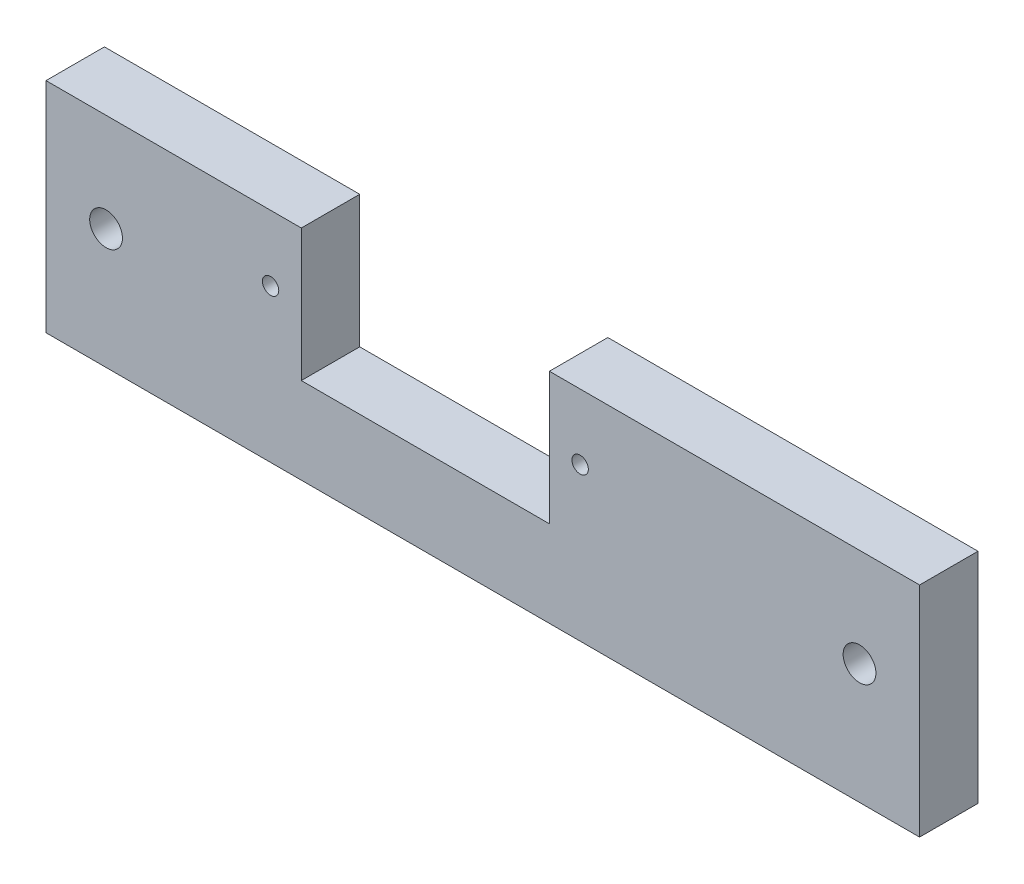
from build123d import *

# Parameters (mm, degrees)
MODEL_R             = 0.75
MODEL_R_2           = 1.5
BOSS_EXTRUDE1_DEPTH = 5.35


with BuildPart() as part:
    # Model → Boss-Extrude1 (new body)
    with BuildSketch(Plane.XY):
        Polygon((0, 19.999999553), (23.379998282, 19.999999553), (23.379998282, 7.899999851), (46.099998988, 7.899999851), (46.099998988, 19.999999553), (79.999998212, 19.999999553), (79.999998212, 0), (0, 0), align=None)
        with Locations((48.913674269, 13.999999776)):
            Circle(MODEL_R, mode=Mode.SUBTRACT)
        with Locations((20.566323943, 13.999999776)):
            Circle(MODEL_R, mode=Mode.SUBTRACT)
        with Locations((74.499999106, 10.999999776)):
            Circle(MODEL_R_2, mode=Mode.SUBTRACT)
        with Locations((5.499999106, 10.999999776)):
            Circle(MODEL_R_2, mode=Mode.SUBTRACT)
    extrude(amount=BOSS_EXTRUDE1_DEPTH)


solid = part.part
